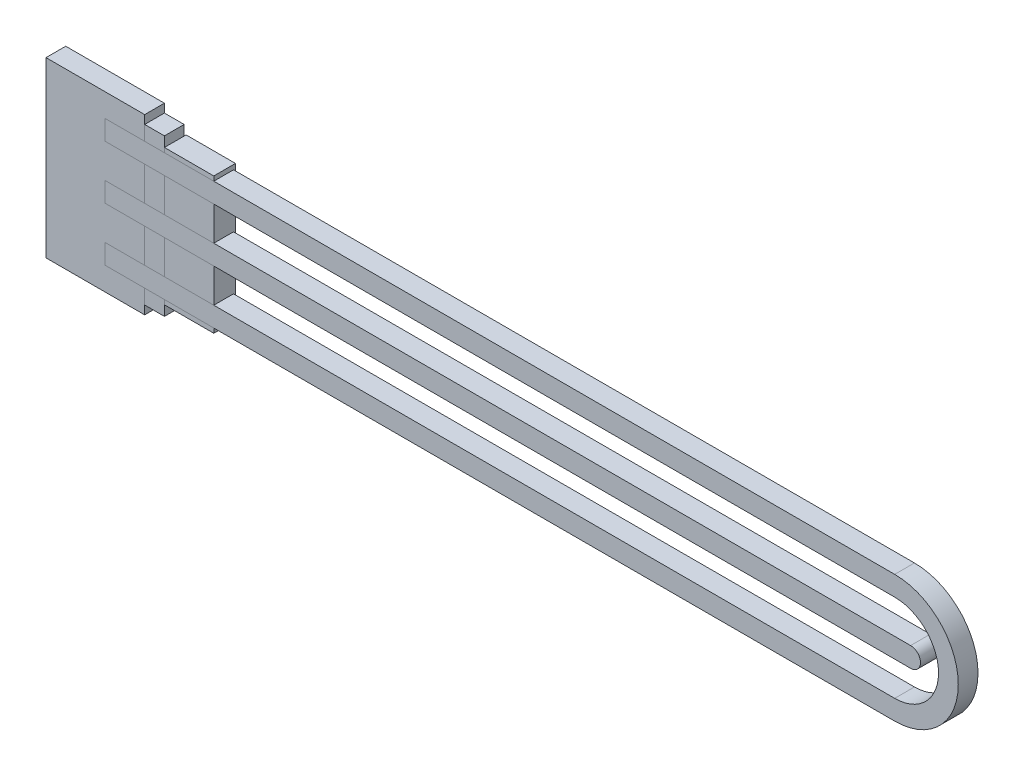
from build123d import *

# Parameters (mm, degrees)
BOSS_EXTRUDE1_DEPTH      = 10
BOSS_EXTRUDE1_2_DEPTH    = 10
SKETCH2_R                = 3
BOSS_EXTRUDE2_DEPTH      = 15
SKETCH3_R                = 3
BOSS_EXTRUDE3_DEPTH      = 15
BOSS_EXTRUDE4_DEPTH      = 10
BOSS_EXTRUDE4_DEPTH_BACK = 1
SKETCH4_W                = 25
SKETCH4_H                = 69.034871012
SKETCH5_W                = 10
SKETCH5_H                = 39.614540043
BOSS_EXTRUDE6_DEPTH      = 10
SKETCH6_W                = 50
SKETCH6_H                = 87.884968957
BOSS_EXTRUDE7_DEPTH      = 10


with BuildPart() as part:
    # Sketch1 → Boss-Extrude1 (new body)
    with BuildSketch(Plane.XY):
        with BuildLine():
            Line((0, 0), (400, 0))
            ThreePointArc((400, 0), (432.204842223, -32.204842223), (400, -64.409684446))
            Line((400, -64.409684446), (0, -64.409684446))
            Line((0, -64.409684446), (0, -54.409684446))
            Line((0, -54.409684446), (400, -54.409684446))
            ThreePointArc((400, -54.409684446), (422.204842223, -32.204842223), (400, -10))
            Line((400, -10), (0, -10))
            Line((0, -10), (0, 0))
        make_face()
    extrude(amount=BOSS_EXTRUDE1_DEPTH)


with BuildPart() as body_2:
    # Sketch1 → Boss-Extrude1 2 (new body)
    with BuildSketch(Plane.XY):
        with BuildLine():
            Line((0, -27.204842223), (408.064158914, -27.204842223))
            ThreePointArc((408.064158914, -27.204842223), (413.064158914, -32.204842223), (408.064158914, -37.204842223))
            Line((408.064158914, -37.204842223), (0, -37.204842223))
            Line((0, -37.204842223), (0, -27.204842223))
        make_face()
    extrude(amount=BOSS_EXTRUDE1_2_DEPTH)


with BuildPart() as body_3:
    # Sketch2 → Boss-Extrude2 (new body)
    with BuildSketch(Plane.ZY):
        with Locations((5, -4.906979909)):
            Circle(SKETCH2_R)
    extrude(amount=BOSS_EXTRUDE2_DEPTH)


with BuildPart() as body_4:
    # Sketch3 → Boss-Extrude3 (new body)
    with BuildSketch(Plane.ZY):
        with Locations((5, -59.409684446)):
            Circle(SKETCH3_R)
    extrude(amount=BOSS_EXTRUDE3_DEPTH)


with BuildPart() as body_5:
    # Sketch4 → Boss-Extrude4 (new, two sides: drawn at the far end of the back side and taken through both)
    with BuildSketch(Plane.XY.offset(-BOSS_EXTRUDE4_DEPTH_BACK)):
        with Locations((42.5, -32.204842223)):
            Rectangle(SKETCH4_W, SKETCH4_H)
    extrude(amount=BOSS_EXTRUDE4_DEPTH + BOSS_EXTRUDE4_DEPTH_BACK)


with BuildPart() as body_6:
    # Sketch5 → Boss-Extrude6 (new body)
    with BuildSketch(Plane.XY):
        with Locations((25, -12.397572201)):
            Rectangle(SKETCH5_W, SKETCH5_H)
        with Locations((25, -52.012112245)):
            Rectangle(SKETCH5_W, SKETCH5_H)
    extrude(amount=BOSS_EXTRUDE6_DEPTH)


with BuildPart() as body_7:
    # Sketch6 → Boss-Extrude7 (new body)
    with BuildSketch(Plane.XY):
        with Locations((-5, -32.204842224)):
            Rectangle(SKETCH6_W, SKETCH6_H)
    extrude(amount=BOSS_EXTRUDE7_DEPTH)


solid = Compound([part.part, body_2.part, body_3.part, body_4.part, body_5.part, body_6.part, body_7.part])
